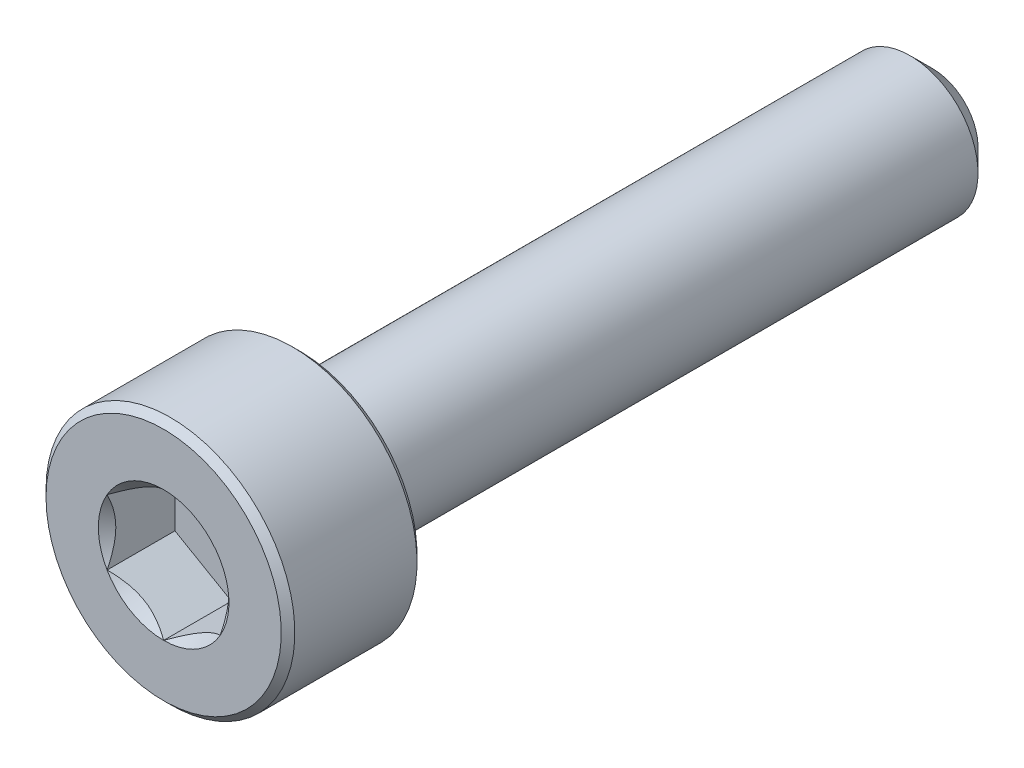
from build123d import *

# Parameters (mm, degrees)
CUT_EXTRUDE1_START = -1.5
CUT_EXTRUDE1_DEPTH = 1.5
SKETCH4_R          = 1.443375673
CUT_EXTRUDE2_DEPTH = 0.5
CUT_EXTRUDE2_DRAFT = -45


with BuildPart() as part:
    # Sketch2 → Revolve1 (revolve)
    with BuildSketch(Plane(origin=(0, 0, 0), x_dir=(0, 0, -1), z_dir=(1, 0, 0)), mode=Mode.PRIVATE) as revolve1_sk:
        Polygon((-8.35, 2.75), (-5.65, 2.75), (-5.5, 2.6), (-5.5, 1.5), (8, 1.5), (8.5, 1), (8.5, 0), (-8.5, 0), (-8.5, 2.6), align=None)
    revolve(revolve1_sk.sketch.rotate(Axis((0, 0, -8.5), (0, 0, 1)), 90), axis=Axis((0, 0, -8.5), (0, 0, 1)))

    # Sketch3 → Cut-Extrude1 (cut)
    with BuildSketch(Plane.XY.offset(8.5).offset(CUT_EXTRUDE1_START)):
        Polygon((0, 1.443375673), (-1.25, 0.721687836), (-1.25, -0.721687836), (0, -1.443375673), (1.25, -0.721687836), (1.25, 0.721687836), align=None)
    extrude(amount=CUT_EXTRUDE1_DEPTH, mode=Mode.SUBTRACT)


with BuildPart() as cut_extrude2_tool:
    # Sketch4 → Cut-Extrude2 (with draft: the straight prism first)
    with BuildSketch(Plane.XY.offset(8.5)):
        Circle(SKETCH4_R)
    extrude(amount=-CUT_EXTRUDE2_DEPTH)
    # Cut-Extrude2: the draft: its side faces are tilted about the plane it starts from
    cut_extrude2_sides = [cut_extrude2_tool.faces().sort_by_distance(p)[0] for p in [
        (-1.443375673, 0, 8.25),
    ]]
    draft(cut_extrude2_sides, Plane.XY.offset(8.5), CUT_EXTRUDE2_DRAFT)


with BuildPart() as part_1:
    add(part.part)

    # Cut-Extrude2: cut by cut_extrude2_tool
    add(cut_extrude2_tool.part, mode=Mode.SUBTRACT)


solid = part_1.part
